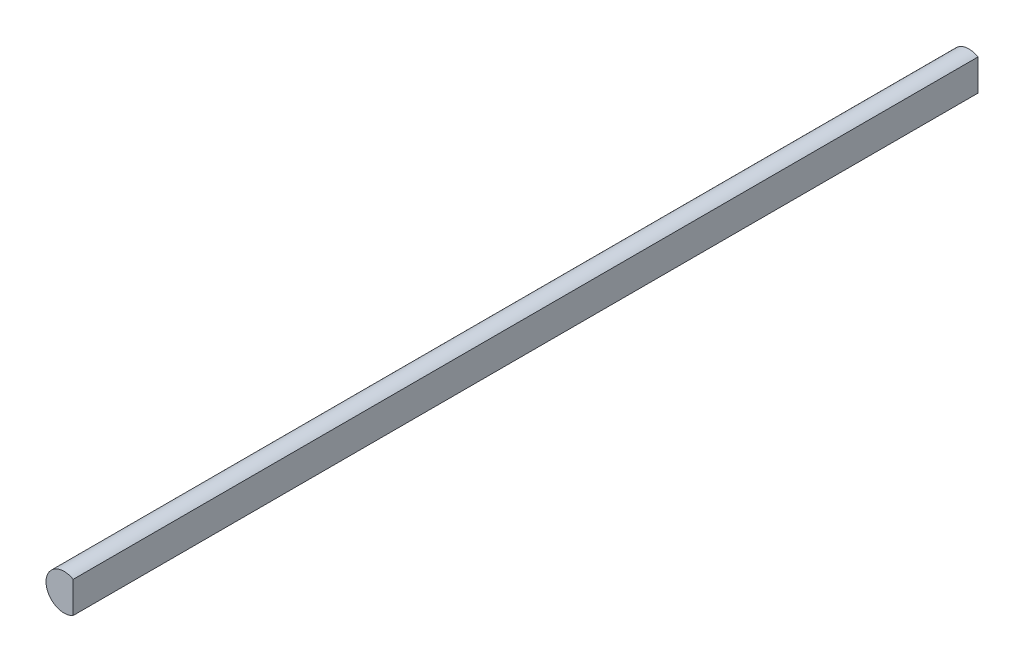
from build123d import *

# Parameters (mm, degrees)
EXTRUDE_1_DEPTH = 50


with BuildPart() as part:
    # 草图1 → 凸台-拉伸1 (new, symmetric)
    with BuildSketch(Plane.XY):
        with BuildLine():
            Line((1, 1.732050808), (1, -1.732050808))
            ThreePointArc((1, -1.732050808), (-2, 0), (1, 1.732050808))
        make_face()
    extrude(amount=EXTRUDE_1_DEPTH, both=True)


solid = part.part
